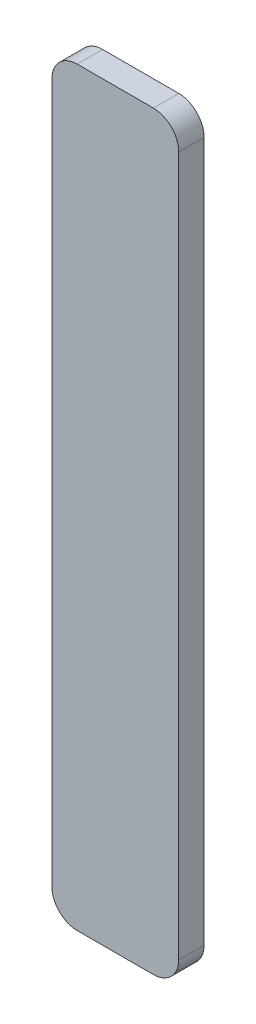
from build123d import *

# Parameters (mm, degrees)
BOSS_EXTRUDE1_DEPTH = 1


with BuildPart() as part:
    # Sketch1 → Boss-Extrude1 (new body)
    with BuildSketch(Plane.XY):
        with BuildLine():
            Line((-2.5, 28.58), (-2.5, 1))
            ThreePointArc((-2.5, 1), (-2.207106781, 0.292893219), (-1.5, 0))
            Line((-1.5, 0), (1.5, 0))
            ThreePointArc((1.5, 0), (2.207106781, 0.292893219), (2.5, 1))
            Line((2.5, 1), (2.5, 28.58))
            ThreePointArc((2.5, 28.58), (2.207106781, 29.287106781), (1.5, 29.58))
            Line((1.5, 29.58), (-1.5, 29.58))
            ThreePointArc((-1.5, 29.58), (-2.207106781, 29.287106781), (-2.5, 28.58))
        make_face()
    extrude(amount=BOSS_EXTRUDE1_DEPTH)


solid = part.part
